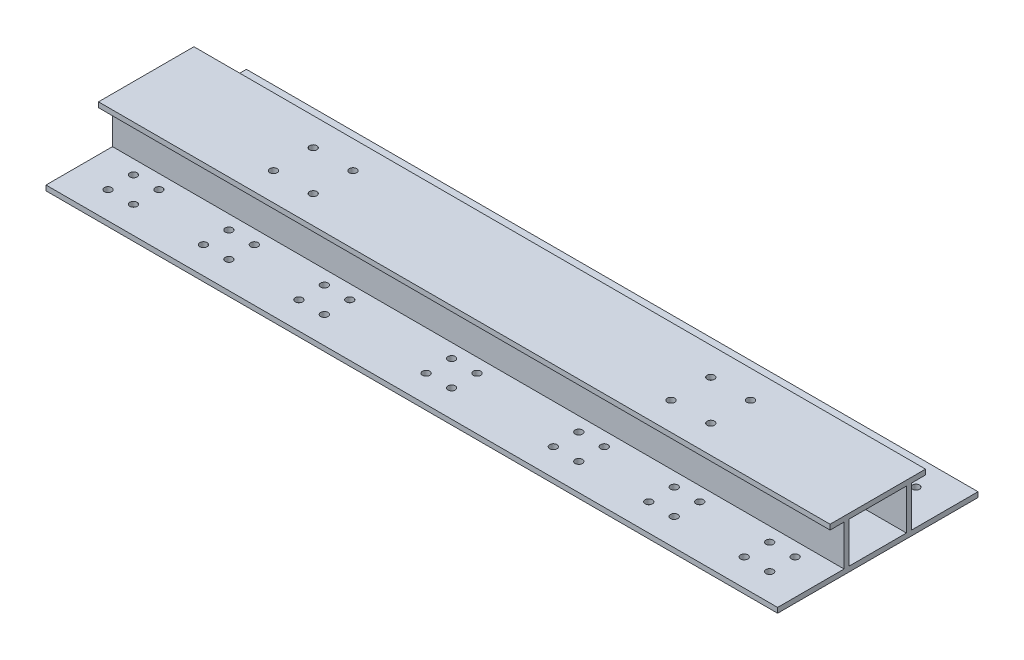
from build123d import *

# Parameters (mm, degrees)
SKETCH_7_W          = 180
SKETCH_7_H          = 128
EXTRUDE_1_DEPTH     = 2300
SKETCH_8_R          = 11.5
CUT_EXTRUDE_1_DEPTH = 16
SKETCH_9_R          = 11.5
CUT_EXTRUDE_2_DEPTH = 16


with BuildPart() as part:
    # 草图7 → 凸台-拉伸1 (new body)
    with BuildSketch(Plane(origin=(0, 0, 0), x_dir=(0, 0, -1), z_dir=(1, 0, 0))):
        Polygon((-315, 16), (-315, 0), (315, 0), (315, 16), (106, 16), (106, 144), (150, 144), (150, 160), (-150, 160), (-150, 144), (-106, 144), (-106, 16), align=None)
        with Locations((0, 80)):
            Rectangle(SKETCH_7_W, SKETCH_7_H, mode=Mode.SUBTRACT)
    extrude(amount=EXTRUDE_1_DEPTH)

    # 草图8 → 切除-拉伸1 (cut)
    with BuildSketch(Plane(origin=(0, 160, 0), x_dir=(1, 0, 0), z_dir=(0, 1, 0))):
        with Locations(Location((462.5, 62.5, 0), (0, 0, 270))):
            Circle(SKETCH_8_R)
        with Locations(Location((587.5, 62.5, 0), (0, 0, 270))):
            Circle(SKETCH_8_R)
        with Locations(Location((462.5, -62.5, 0), (0, 0, 270))):
            Circle(SKETCH_8_R)
        with Locations(Location((587.5, -62.5, 0), (0, 0, 270))):
            Circle(SKETCH_8_R)
        with Locations(Location((1712.5, 62.5, 0), (0, 0, 270))):
            Circle(SKETCH_8_R)
        with Locations(Location((1837.5, 62.5, 0), (0, 0, 270))):
            Circle(SKETCH_8_R)
        with Locations(Location((1712.5, -62.5, 0), (0, 0, 270))):
            Circle(SKETCH_8_R)
        with Locations(Location((1837.5, -62.5, 0), (0, 0, 270))):
            Circle(SKETCH_8_R)
    extrude(amount=-CUT_EXTRUDE_1_DEPTH, mode=Mode.SUBTRACT)

    # 草图9 → 切除-拉伸2 (cut)
    with BuildSketch(Plane.XZ):
        with Locations(Location((110, 230, 0), (0, 0, 270))):
            Circle(SKETCH_9_R)
        with Locations(Location((190, 230, 0), (0, 0, 270))):
            Circle(SKETCH_9_R)
        with Locations(Location((410, 230, 0), (0, 0, 270))):
            Circle(SKETCH_9_R)
        with Locations(Location((490, 230, 0), (0, 0, 270))):
            Circle(SKETCH_9_R)
        with Locations(Location((710, 230, 0), (0, 0, 270))):
            Circle(SKETCH_9_R)
        with Locations(Location((790, 230, 0), (0, 0, 270))):
            Circle(SKETCH_9_R)
        with Locations(Location((110, 150, 0), (0, 0, 270))):
            Circle(SKETCH_9_R)
        with Locations(Location((190, 150, 0), (0, 0, 270))):
            Circle(SKETCH_9_R)
        with Locations(Location((410, 150, 0), (0, 0, 270))):
            Circle(SKETCH_9_R)
        with Locations(Location((490, 150, 0), (0, 0, 270))):
            Circle(SKETCH_9_R)
        with Locations(Location((710, 150, 0), (0, 0, 270))):
            Circle(SKETCH_9_R)
        with Locations(Location((790, 150, 0), (0, 0, 270))):
            Circle(SKETCH_9_R)
        with Locations(Location((110, -150, 0), (0, 0, 270))):
            Circle(SKETCH_9_R)
        with Locations(Location((190, -150, 0), (0, 0, 270))):
            Circle(SKETCH_9_R)
        with Locations(Location((190, -230, 0), (0, 0, 270))):
            Circle(SKETCH_9_R)
        with Locations(Location((110, -230, 0), (0, 0, 270))):
            Circle(SKETCH_9_R)
        with Locations(Location((410, -150, 0), (0, 0, 270))):
            Circle(SKETCH_9_R)
        with Locations(Location((490, -150, 0), (0, 0, 270))):
            Circle(SKETCH_9_R)
        with Locations(Location((410, -230, 0), (0, 0, 270))):
            Circle(SKETCH_9_R)
        with Locations(Location((490, -230, 0), (0, 0, 270))):
            Circle(SKETCH_9_R)
        with Locations(Location((710, -150, 0), (0, 0, 270))):
            Circle(SKETCH_9_R)
        with Locations(Location((790, -150, 0), (0, 0, 270))):
            Circle(SKETCH_9_R)
        with Locations(Location((710, -230, 0), (0, 0, 270))):
            Circle(SKETCH_9_R)
        with Locations(Location((790, -230, 0), (0, 0, 270))):
            Circle(SKETCH_9_R)
        with Locations(Location((1110, -150, 0), (0, 0, 270))):
            Circle(SKETCH_9_R)
        with Locations(Location((1110, -230, 0), (0, 0, 270))):
            Circle(SKETCH_9_R)
        with Locations(Location((1190, -150, 0), (0, 0, 270))):
            Circle(SKETCH_9_R)
        with Locations(Location((1190, -230, 0), (0, 0, 270))):
            Circle(SKETCH_9_R)
        with Locations(Location((1110, 230, 0), (0, 0, 270))):
            Circle(SKETCH_9_R)
        with Locations(Location((1110, 150, 0), (0, 0, 270))):
            Circle(SKETCH_9_R)
        with Locations(Location((1190, 230, 0), (0, 0, 270))):
            Circle(SKETCH_9_R)
        with Locations(Location((1190, 150, 0), (0, 0, 270))):
            Circle(SKETCH_9_R)
        with Locations(Location((1510, 230, 0), (0, 0, 270))):
            Circle(SKETCH_9_R)
        with Locations(Location((1510, 150, 0), (0, 0, 270))):
            Circle(SKETCH_9_R)
        with Locations(Location((1590, 230, 0), (0, 0, 270))):
            Circle(SKETCH_9_R)
        with Locations(Location((1590, 150, 0), (0, 0, 270))):
            Circle(SKETCH_9_R)
        with Locations(Location((1510, -150, 0), (0, 0, 270))):
            Circle(SKETCH_9_R)
        with Locations(Location((1590, -150, 0), (0, 0, 270))):
            Circle(SKETCH_9_R)
        with Locations(Location((1510, -230, 0), (0, 0, 270))):
            Circle(SKETCH_9_R)
        with Locations(Location((1590, -230, 0), (0, 0, 270))):
            Circle(SKETCH_9_R)
        with Locations(Location((1810, 230, 0), (0, 0, 270))):
            Circle(SKETCH_9_R)
        with Locations(Location((1890, 230, 0), (0, 0, 270))):
            Circle(SKETCH_9_R)
        with Locations(Location((1810, 150, 0), (0, 0, 270))):
            Circle(SKETCH_9_R)
        with Locations(Location((1890, 150, 0), (0, 0, 270))):
            Circle(SKETCH_9_R)
        with Locations(Location((1810, -150, 0), (0, 0, 270))):
            Circle(SKETCH_9_R)
        with Locations(Location((1890, -150, 0), (0, 0, 270))):
            Circle(SKETCH_9_R)
        with Locations(Location((1810, -230, 0), (0, 0, 270))):
            Circle(SKETCH_9_R)
        with Locations(Location((1890, -230, 0), (0, 0, 270))):
            Circle(SKETCH_9_R)
        with Locations(Location((2110, 230, 0), (0, 0, 270))):
            Circle(SKETCH_9_R)
        with Locations(Location((2190, 230, 0), (0, 0, 270))):
            Circle(SKETCH_9_R)
        with Locations(Location((2110, 150, 0), (0, 0, 270))):
            Circle(SKETCH_9_R)
        with Locations(Location((2190, 150, 0), (0, 0, 270))):
            Circle(SKETCH_9_R)
        with Locations(Location((2110, -150, 0), (0, 0, 270))):
            Circle(SKETCH_9_R)
        with Locations(Location((2190, -150, 0), (0, 0, 270))):
            Circle(SKETCH_9_R)
        with Locations(Location((2110, -230, 0), (0, 0, 270))):
            Circle(SKETCH_9_R)
        with Locations(Location((2190, -230, 0), (0, 0, 270))):
            Circle(SKETCH_9_R)
    extrude(amount=-CUT_EXTRUDE_2_DEPTH, mode=Mode.SUBTRACT)


solid = part.part
